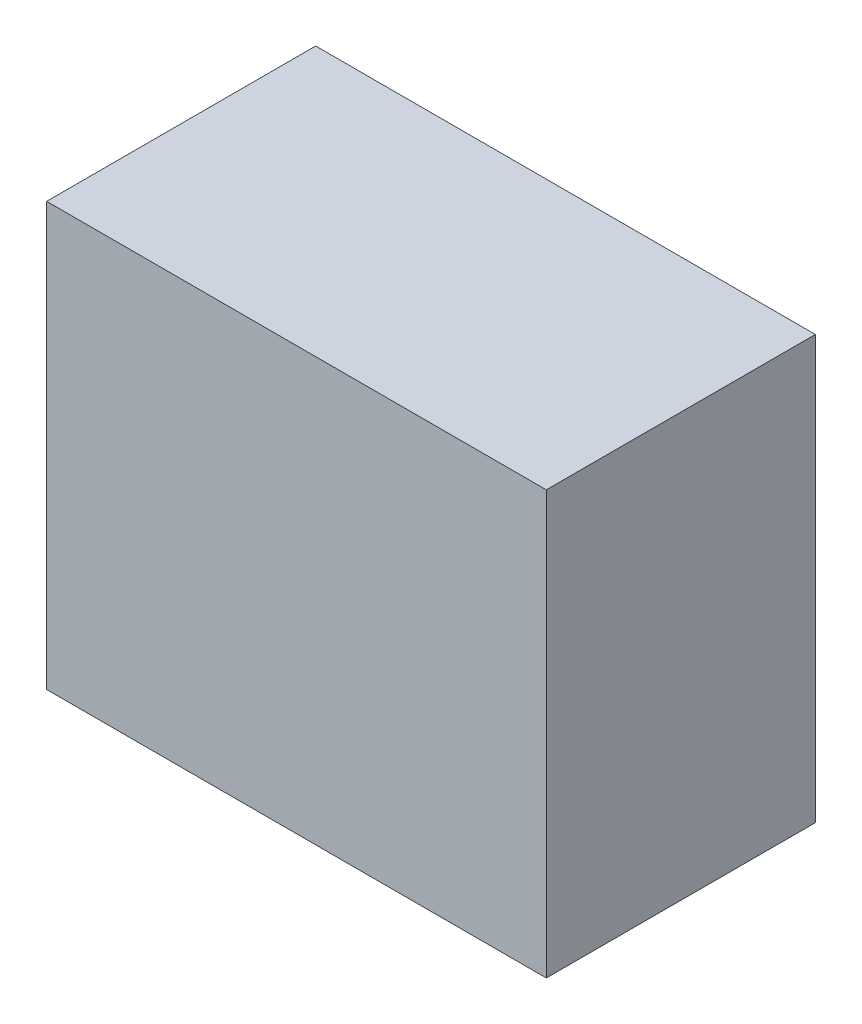
from build123d import *

# Parameters (mm, degrees)
SKETCH1_W           = 65
SKETCH1_H           = 55
BOSS_EXTRUDE1_DEPTH = 35
SKETCH2_W           = 31
SKETCH2_H           = 51
CUT_EXTRUDE1_DEPTH  = 60


with BuildPart() as part:
    # Sketch1 → Boss-Extrude1 (new body)
    with BuildSketch(Plane.XY):
        Rectangle(SKETCH1_W, SKETCH1_H)
    extrude(amount=BOSS_EXTRUDE1_DEPTH)

    # Sketch2 → Cut-Extrude1 (cut)
    with BuildSketch(Plane.ZY.offset(32.5)):
        with Locations((17.5, 0)):
            Rectangle(SKETCH2_W, SKETCH2_H)
    extrude(amount=-CUT_EXTRUDE1_DEPTH, mode=Mode.SUBTRACT)


solid = part.part
